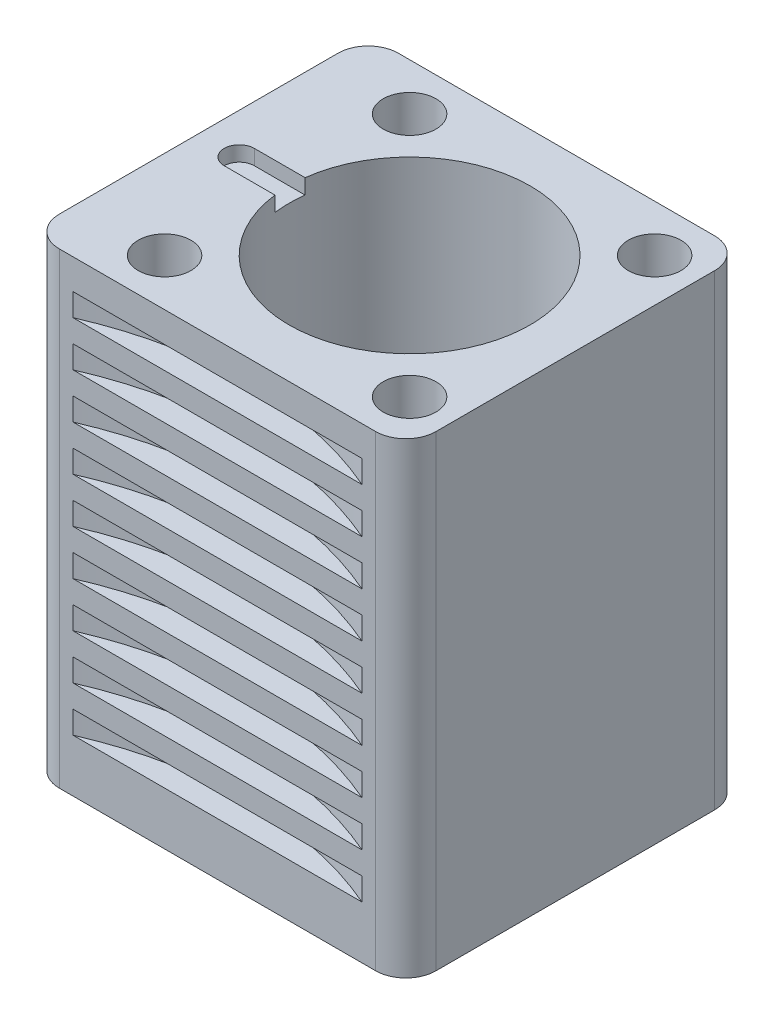
from build123d import *

# Parameters (mm, degrees)
BOSS_EXTRUDE1_DEPTH     = 62
SKETCH3_R               = 18
BOSS_EXTRUDE2_DEPTH     = 2
SKETCH4_R               = 16
CUT_EXTRUDE1_DEPTH      = 74.391075752
CUT_EXTRUDE2_DEPTH      = 2
SKETCH8_R               = 3.5
CUT_EXTRUDE3_DEPTH      = 74.391075752
SKETCH9_W               = 48
SKETCH9_H               = 3
LPATTERN1_COUNT         = 9
LPATTERN1_PITCH         = 6
MIRROR1_COPY_1_SKETCH_W = 48
MIRROR1_COPY_1_SKETCH_H = 3
MIRROR1_COPY_2_SKETCH_W = 48
MIRROR1_COPY_2_SKETCH_H = 3
MIRROR1_COPY_3_SKETCH_W = 48
MIRROR1_COPY_3_SKETCH_H = 3
MIRROR1_COPY_4_SKETCH_W = 48
MIRROR1_COPY_4_SKETCH_H = 3
MIRROR1_COPY_5_SKETCH_W = 48
MIRROR1_COPY_5_SKETCH_H = 3
MIRROR1_COPY_6_SKETCH_W = 48
MIRROR1_COPY_6_SKETCH_H = 3
MIRROR1_COPY_7_SKETCH_W = 48
MIRROR1_COPY_7_SKETCH_H = 3
MIRROR1_COPY_8_SKETCH_W = 48
MIRROR1_COPY_8_SKETCH_H = 3
SKETCH11_W              = 48
SKETCH11_H              = 3
LPATTERN2_COUNT         = 9
LPATTERN2_PITCH         = 6


with BuildPart() as part:
    # Sketch2 → Boss-Extrude1 (new body)
    with BuildSketch(Plane(origin=(0, 0, 0), x_dir=(1, 0, 0), z_dir=(0, 1, 0))):
        with BuildLine():
            Line((18, 22.5), (-24, 22.5))
            ThreePointArc((-24, 22.5), (-26.828427125, 21.328427125), (-28, 18.5))
            Line((-28, 18.5), (-28, -18.5))
            ThreePointArc((-28, -18.5), (-26.828427125, -21.328427125), (-24, -22.5))
            Line((-24, -22.5), (18, -22.5))
            ThreePointArc((18, -22.5), (20.828427125, -21.328427125), (22, -18.5))
            Line((22, -18.5), (22, 18.5))
            ThreePointArc((22, 18.5), (20.828427125, 21.328427125), (18, 22.5))
        make_face()
    extrude(amount=BOSS_EXTRUDE1_DEPTH)

    # Sketch3 → Boss-Extrude2 (add)
    with BuildSketch(Plane.XZ):
        with Locations(Location((0, 0, 0), (0, 0, 270))):
            Circle(SKETCH3_R)
    extrude(amount=BOSS_EXTRUDE2_DEPTH)

    # Sketch4 → Cut-Extrude1 (cut, through all)
    with BuildSketch(Plane.XZ.offset(2)):
        with Locations(Location((0, 0, 0), (0, 0, 270))):
            Circle(SKETCH4_R)
    extrude(amount=-CUT_EXTRUDE1_DEPTH, mode=Mode.SUBTRACT)

    # Sketch7 → Cut-Extrude2 (cut)
    with BuildSketch(Plane(origin=(0, 62, 0), x_dir=(1, 0, 0), z_dir=(0, 1, 0))):
        with BuildLine():
            Line((-22.61, 2), (-11.009311248, 2))
            Line((-11.009311248, 2), (-11.009311248, -2))
            Line((-11.009311248, -2), (-22.61, -2))
            ThreePointArc((-22.61, -2), (-24.61, 0), (-22.61, 2))
        make_face()
    extrude(amount=-CUT_EXTRUDE2_DEPTH, mode=Mode.SUBTRACT)

    # Sketch8 → Cut-Extrude3 (cut, through all)
    with BuildSketch(Plane(origin=(0, 62, 0), x_dir=(1, 0, 0), z_dir=(0, 1, 0))):
        with Locations(Location((16.263455967, 16.263455967, 0), (0, 0, 270))):
            Circle(SKETCH8_R)
        with Locations(Location((16.263455967, -16.263455967, 0), (0, 0, 270))):
            Circle(SKETCH8_R)
        with Locations(Location((-16.263455967, -16.263455967, 0), (0, 0, 270))):
            Circle(SKETCH8_R)
        with Locations(Location((-16.263455967, 16.263455967, 0), (0, 0, 270))):
            Circle(SKETCH8_R)
    extrude(amount=-CUT_EXTRUDE3_DEPTH, mode=Mode.SUBTRACT)

    # Sketch9 → Cut-Revolve1 (revolve, cut)
    with BuildSketch(Plane(origin=(-3, 0, 0), x_dir=(0, 0, -1), z_dir=(1, 0, 0))):
        with Locations((-42.5, 56.5)):
            Rectangle(SKETCH9_W, SKETCH9_H)
    cut_revolve1 = revolve(axis=Axis((-3, 58, 66.5), (0, -1, 0)), mode=Mode.SUBTRACT)

    # LPattern1: Cut-Revolve1 ×9
    with Locations(*[(0, -i * LPATTERN1_PITCH, 0) for i in range(1, LPATTERN1_COUNT)]):
        add(cut_revolve1, mode=Mode.SUBTRACT)

    # Mirror1: Cut-Revolve1 across plane
    add(cut_revolve1.mirror(Plane.XY), mode=Mode.SUBTRACT)

    # Mirror1 copy 1 sketch → Mirror1 copy 1 (revolve, cut)
    with BuildSketch(Plane(origin=(-3, -6, 0), x_dir=(0, 0, 1), z_dir=(1, 0, 0))):
        with Locations((-42.5, -56.5)):
            Rectangle(MIRROR1_COPY_1_SKETCH_W, MIRROR1_COPY_1_SKETCH_H)
    revolve(axis=Axis((-3, 52, -66.5), (0, 1, 0)), mode=Mode.SUBTRACT)

    # Mirror1 copy 2 sketch → Mirror1 copy 2 (revolve, cut)
    with BuildSketch(Plane(origin=(-3, -12, 0), x_dir=(0, 0, 1), z_dir=(1, 0, 0))):
        with Locations((-42.5, -56.5)):
            Rectangle(MIRROR1_COPY_2_SKETCH_W, MIRROR1_COPY_2_SKETCH_H)
    revolve(axis=Axis((-3, 46, -66.5), (0, 1, 0)), mode=Mode.SUBTRACT)

    # Mirror1 copy 3 sketch → Mirror1 copy 3 (revolve, cut)
    with BuildSketch(Plane(origin=(-3, -18, 0), x_dir=(0, 0, 1), z_dir=(1, 0, 0))):
        with Locations((-42.5, -56.5)):
            Rectangle(MIRROR1_COPY_3_SKETCH_W, MIRROR1_COPY_3_SKETCH_H)
    revolve(axis=Axis((-3, 40, -66.5), (0, 1, 0)), mode=Mode.SUBTRACT)

    # Mirror1 copy 4 sketch → Mirror1 copy 4 (revolve, cut)
    with BuildSketch(Plane(origin=(-3, -24, 0), x_dir=(0, 0, 1), z_dir=(1, 0, 0))):
        with Locations((-42.5, -56.5)):
            Rectangle(MIRROR1_COPY_4_SKETCH_W, MIRROR1_COPY_4_SKETCH_H)
    revolve(axis=Axis((-3, 34, -66.5), (0, 1, 0)), mode=Mode.SUBTRACT)

    # Mirror1 copy 5 sketch → Mirror1 copy 5 (revolve, cut)
    with BuildSketch(Plane(origin=(-3, -30, 0), x_dir=(0, 0, 1), z_dir=(1, 0, 0))):
        with Locations((-42.5, -56.5)):
            Rectangle(MIRROR1_COPY_5_SKETCH_W, MIRROR1_COPY_5_SKETCH_H)
    revolve(axis=Axis((-3, 28, -66.5), (0, 1, 0)), mode=Mode.SUBTRACT)

    # Mirror1 copy 6 sketch → Mirror1 copy 6 (revolve, cut)
    with BuildSketch(Plane(origin=(-3, -36, 0), x_dir=(0, 0, 1), z_dir=(1, 0, 0))):
        with Locations((-42.5, -56.5)):
            Rectangle(MIRROR1_COPY_6_SKETCH_W, MIRROR1_COPY_6_SKETCH_H)
    revolve(axis=Axis((-3, 22, -66.5), (0, 1, 0)), mode=Mode.SUBTRACT)

    # Mirror1 copy 7 sketch → Mirror1 copy 7 (revolve, cut)
    with BuildSketch(Plane(origin=(-3, -42, 0), x_dir=(0, 0, 1), z_dir=(1, 0, 0))):
        with Locations((-42.5, -56.5)):
            Rectangle(MIRROR1_COPY_7_SKETCH_W, MIRROR1_COPY_7_SKETCH_H)
    revolve(axis=Axis((-3, 16, -66.5), (0, 1, 0)), mode=Mode.SUBTRACT)

    # Mirror1 copy 8 sketch → Mirror1 copy 8 (revolve, cut)
    with BuildSketch(Plane(origin=(-3, -48, 0), x_dir=(0, 0, 1), z_dir=(1, 0, 0))):
        with Locations((-42.5, -56.5)):
            Rectangle(MIRROR1_COPY_8_SKETCH_W, MIRROR1_COPY_8_SKETCH_H)
    revolve(axis=Axis((-3, 10, -66.5), (0, 1, 0)), mode=Mode.SUBTRACT)

    # Sketch11 → Cut-Revolve3 (revolve, cut)
    with BuildSketch(Plane.XY):
        with Locations((-48, 56.5)):
            Rectangle(SKETCH11_W, SKETCH11_H)
    cut_revolve3 = revolve(axis=Axis((-72, 58, 0), (0, -1, 0)), mode=Mode.SUBTRACT)

    # LPattern2: Cut-Revolve3 ×9
    with Locations(*[(0, -i * LPATTERN2_PITCH, 0) for i in range(1, LPATTERN2_COUNT)]):
        add(cut_revolve3, mode=Mode.SUBTRACT)


solid = part.part
